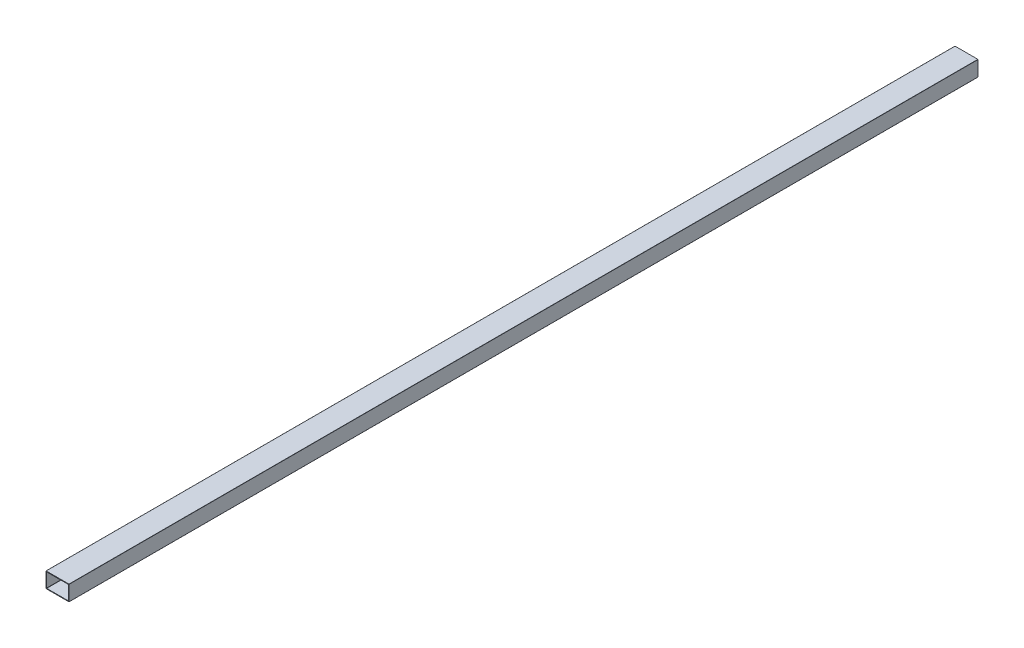
from build123d import *

# Parameters (mm, degrees)
CROQUIS1_W              = 152.4
CROQUIS1_H              = 101.6
CROQUIS1_W_2            = 144.8
CROQUIS1_H_2            = 94
SALIENTE_EXTRUIR1_DEPTH = 6000
REDONDEO1_R             = 1


with BuildPart() as part:
    # Croquis1 → Saliente-Extruir1 (new body)
    with BuildSketch(Plane.XY):
        Rectangle(CROQUIS1_W, CROQUIS1_H)
        Rectangle(CROQUIS1_W_2, CROQUIS1_H_2, mode=Mode.SUBTRACT)
    extrude(amount=-SALIENTE_EXTRUIR1_DEPTH)

    # Redondeo1
    redondeo1_edges = [part.edges().sort_by_distance(p)[0] for p in [
        (72.4, -47, -3000),
        (-72.4, -47, -3000),
        (-72.4, 47, -3000),
        (72.4, 47, -3000),
        (76.2, -50.8, -3000),
        (-76.2, -50.8, -3000),
        (-76.2, 50.8, -3000),
        (76.2, 50.8, -3000),
    ]]
    fillet(redondeo1_edges, radius=REDONDEO1_R)


solid = part.part
